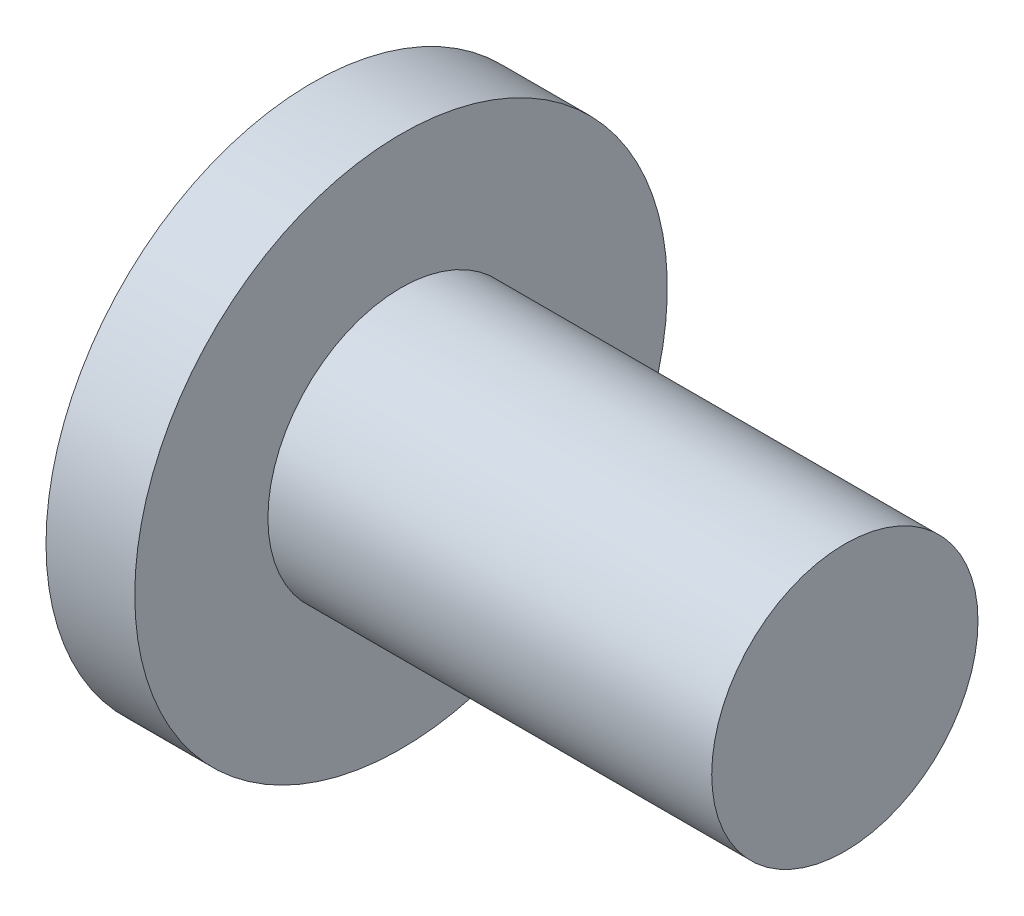
from build123d import *


with BuildPart() as part:
    # Sketch1 → Revolve1 (revolve)
    with BuildSketch(Plane(origin=(0, 0, 0), x_dir=(1, 0, 0), z_dir=(0, 1, 0)), mode=Mode.PRIVATE) as revolve1_sk:
        Polygon((0, 0), (12, 0), (12, 3), (2, 3), (2, 6), (0, 6), align=None)
    revolve(revolve1_sk.sketch.rotate(Axis((0, 0, 0), (1, 0, 0)), 180), axis=Axis((0, 0, 0), (1, 0, 0)))


solid = part.part
